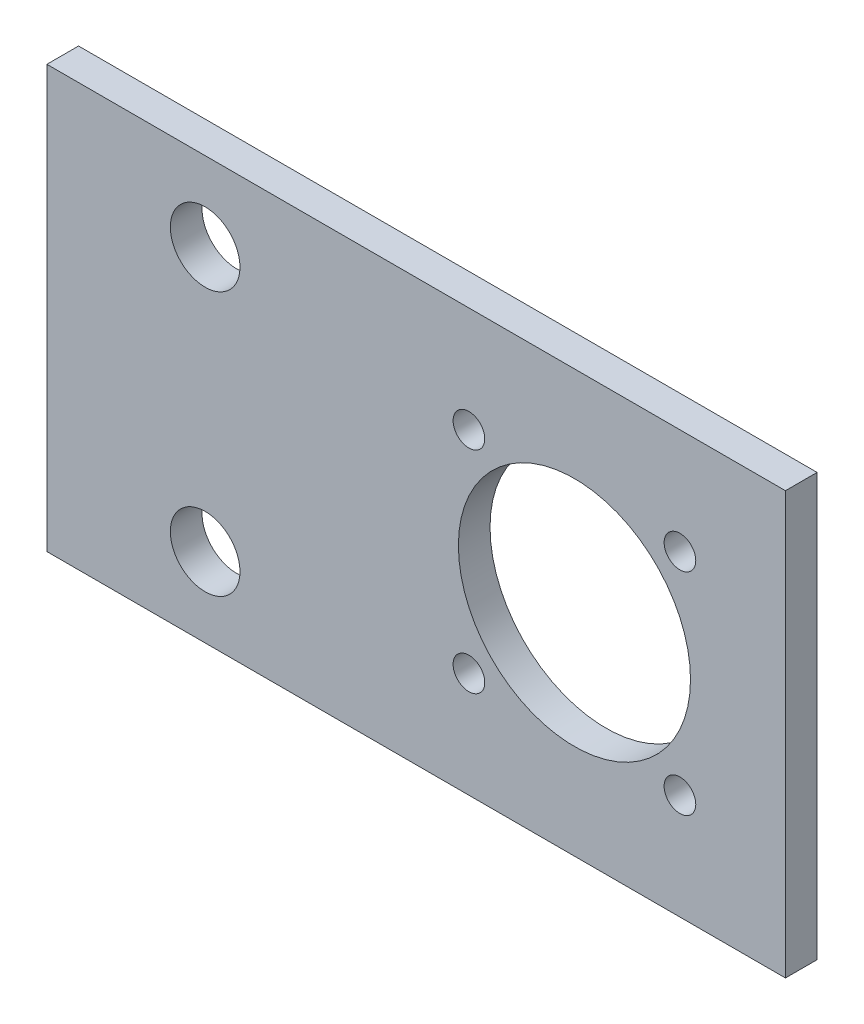
from build123d import *

# Parameters (mm, degrees)
SKIZZE1_W                        = 70
SKIZZE1_H                        = 40
AUFSATZ_LINEAR_AUSTRAGEN1_DEPTH  = 3
F_3_0_3_DURCHMESSER_BOHRUNG2_D   = 3
DURCHGANGSLOCH_F_R_M61_D         = 6.6
F_22_0_22_DURCHMESSER_BOHRUNG1_D = 22


with BuildPart() as part:
    # Skizze1 → Aufsatz-Linear austragen1 (new body)
    with BuildSketch(Plane.XY):
        with Locations((19.450005134, 330)):
            Rectangle(SKIZZE1_W, SKIZZE1_H)
    extrude(amount=AUFSATZ_LINEAR_AUSTRAGEN1_DEPTH)

    # Ø3.0 (3) Durchmesser Bohrung2 (through all)
    with Locations(Plane.XY.offset(3)):
        with Locations((24.450005134, 340), (44.450005134, 340), (44.450005134, 320), (24.450005134, 320)):
            Hole(F_3_0_3_DURCHMESSER_BOHRUNG2_D / 2)

    # Durchgangsloch für M61 (through all)
    with Locations(Plane.XY.offset(3)):
        with Locations((-0.549994866, 342.5), (-0.549994866, 317.5)):
            Hole(DURCHGANGSLOCH_F_R_M61_D / 2)

    # Ø22.0 (22) Durchmesser Bohrung1 (through all)
    with Locations(Plane(origin=(0, 0, 0), x_dir=(-1, 0, 0), z_dir=(0, 0, -1))):
        with Locations((-34.450005134, 330)):
            Hole(F_22_0_22_DURCHMESSER_BOHRUNG1_D / 2)


solid = part.part
